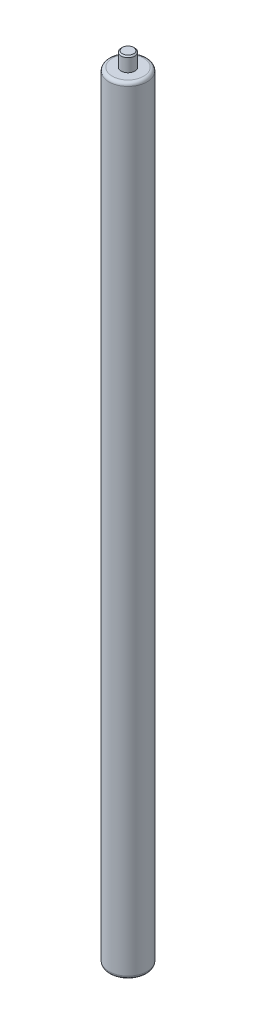
from build123d import *

# Parameters (mm, degrees)
SKETCH1_R           = 11.049
BOSS_EXTRUDE1_DEPTH = 452.12
SKETCH2_R           = 4
BOSS_EXTRUDE2_DEPTH = 8.382
CHAMFER1_SIZE       = 0.762
FILLET1_R           = 1.905
SKETCH3_R           = 4.953
CUT_EXTRUDE1_DEPTH  = 431.8


with BuildPart() as part:
    # Sketch1 → Boss-Extrude1 (new body)
    with BuildSketch(Plane(origin=(0, 0, 0), x_dir=(1, 0, 0), z_dir=(0, 1, 0))):
        with Locations(Location((0, 0, 0), (0, 0, 90))):
            Circle(SKETCH1_R)
    extrude(amount=BOSS_EXTRUDE1_DEPTH)

    # Sketch2 → Boss-Extrude2 (add)
    with BuildSketch(Plane(origin=(0, 452.12, 0), x_dir=(1, 0, 0), z_dir=(0, 1, 0))):
        with Locations(Location((0, 0, 0), (0, 0, 270))):
            Circle(SKETCH2_R)
    extrude(amount=BOSS_EXTRUDE2_DEPTH)

    # Chamfer1
    chamfer1_edges = [part.edges().sort_by_distance(p)[0] for p in [
        (0, 460.502, -4),
    ]]
    chamfer(chamfer1_edges, length=CHAMFER1_SIZE)

    # Fillet1
    fillet1_edges = [part.edges().sort_by_distance(p)[0] for p in [
        (0, 0, 11.049),
        (0, 452.12, 11.049),
    ]]
    fillet(fillet1_edges, radius=FILLET1_R)

    # Sketch3 → Cut-Extrude1 (cut)
    with BuildSketch(Plane.XZ):
        with Locations(Location((0, 0, 0), (0, 0, 270))):
            Circle(SKETCH3_R)
    extrude(amount=-CUT_EXTRUDE1_DEPTH, mode=Mode.SUBTRACT)


solid = part.part
